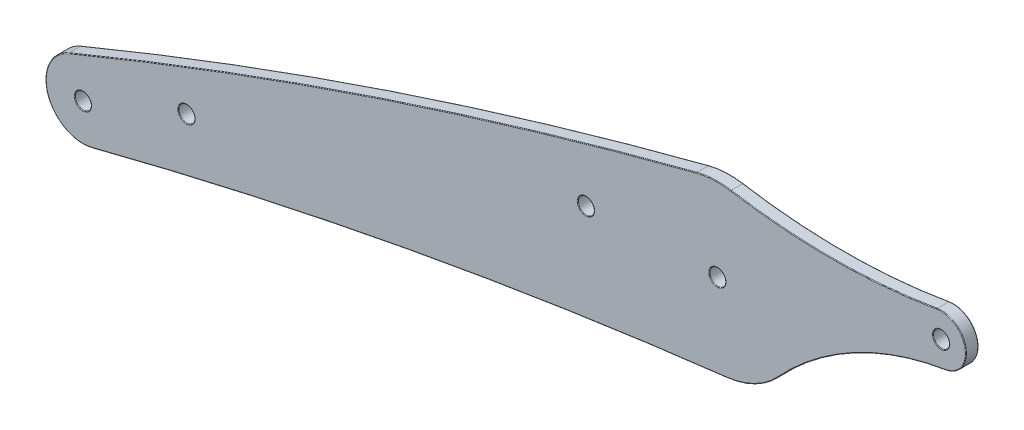
from build123d import *

# Parameters (mm, degrees)
BOSS_EXTRUDE1_DEPTH    = 3
M3_5_CLEARANCE_HOLE1_D = 3.9
FILLET1_R              = 0.15


with BuildPart() as part:
    # Sketch2 → Boss-Extrude1 (new body)
    with BuildSketch(Plane.XY):
        with BuildLine():
            ThreePointArc((-29.872396704, 224.867071511), (-106.538111888, 202.112090376), (-181.437022828, 174.083993915))
            ThreePointArc((-181.437022828, 174.083993915), (-186.527370428, 162.916570473), (-175.74500753, 157.054520032))
            ThreePointArc((-175.74500753, 157.054520032), (-99.619456546, 173.94780372), (-22.524091937, 185.643414098))
            ThreePointArc((-22.524091937, 185.643414098), (-15.770870107, 187.687903342), (-10.147894267, 191.950306897))
            ThreePointArc((-10.147894267, 191.950306897), (8.163865625, 206.152120332), (30.108853086, 213.597224798))
            ThreePointArc((30.108853086, 213.597224798), (35.06621405, 220.508833974), (28.130877596, 225.432945813))
            ThreePointArc((28.130877596, 225.432945813), (3.267937714, 223.261812107), (-21.610844149, 225.243178857))
            ThreePointArc((-21.610844149, 225.243178857), (-25.761273046, 225.486813519), (-29.872396704, 224.867071511))
        make_face()
    extrude(amount=-BOSS_EXTRUDE1_DEPTH)

    # M3.5 Clearance Hole1 (through all)
    with Locations(Plane.XY):
        with Locations((-177.991557982, 165.769622502), (-152.991557982, 175.545617405), (-56.586523143, 204.525451112), (-24.851714699, 205.507506634), (29.148285301, 219.519834824)):
            Hole(M3_5_CLEARANCE_HOLE1_D / 2)

    # Fillet1
    fillet1_edges = [part.edges().sort_by_distance(p)[0] for p in [
        (-99.619456546, 173.94780372, 0),
        (-186.527370428, 162.916570473, 0),
        (-106.538111888, 202.112090376, 0),
        (-25.761273046, 225.486813519, 0),
        (-186.527370428, 162.916570473, -3),
        (-99.619456546, 173.94780372, -3),
        (-15.770870107, 187.687903342, -3),
        (8.163865625, 206.152120332, -3),
        (35.06621405, 220.508833974, -3),
        (31.098285301, 219.519834824, 0),
        (31.098285301, 219.519834824, -3),
        (3.267937714, 223.261812107, -3),
        (-22.901714699, 205.507506634, 0),
        (-22.901714699, 205.507506634, -3),
        (-54.636523143, 204.525451112, 0),
        (-54.636523143, 204.525451112, -3),
        (-151.041557982, 175.545617405, 0),
        (-151.041557982, 175.545617405, -3),
        (-25.761273046, 225.486813519, -3),
        (-176.041557982, 165.769622502, 0),
        (-176.041557982, 165.769622502, -3),
        (3.267937714, 223.261812107, 0),
        (-106.538111888, 202.112090376, -3),
        (35.06621405, 220.508833974, 0),
        (8.163865625, 206.152120332, 0),
        (-15.770870107, 187.687903342, 0),
    ]]
    fillet(fillet1_edges, radius=FILLET1_R)


solid = part.part
